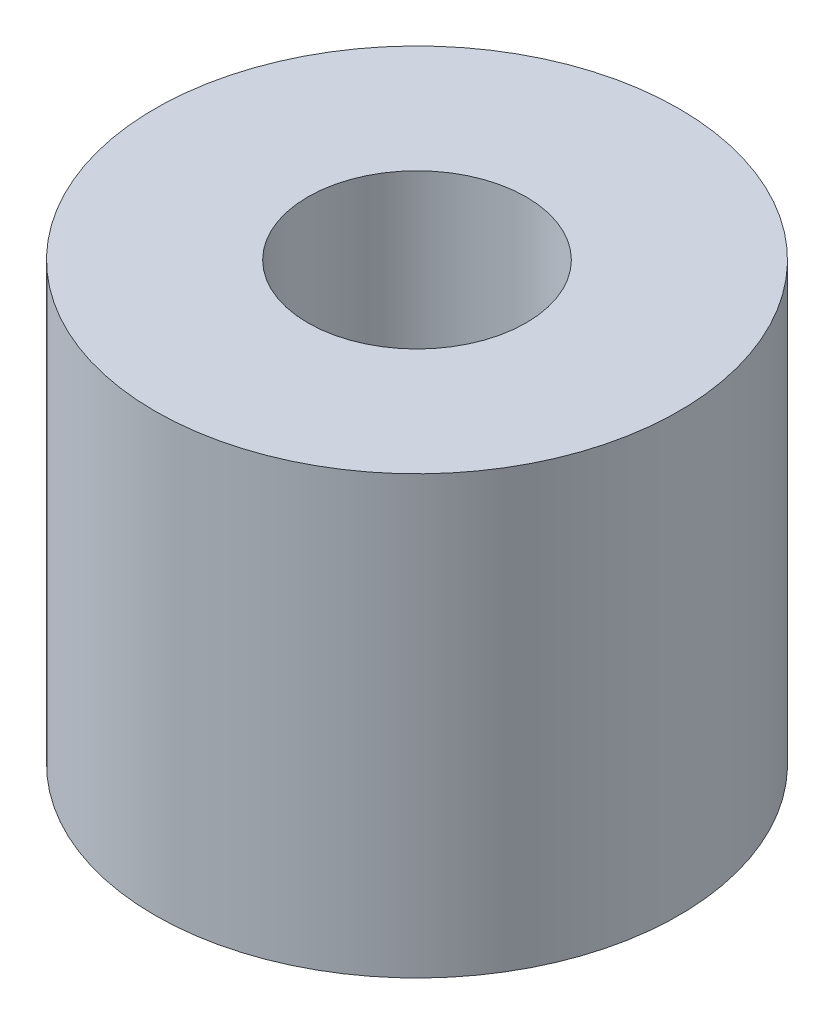
from build123d import *

# Parameters (mm, degrees)
CROQUIS1_R              = 25
SALIENTE_EXTRUIR1_DEPTH = 10
CROQUIS2_R              = 60
SALIENTE_EXTRUIR2_DEPTH = 100
CORTAR_EXTRUIR1_START   = -50
CROQUIS3_R              = 25
CORTAR_EXTRUIR1_DEPTH   = 50


with BuildPart() as part:
    # Croquis1 → Saliente-Extruir1 (new body)
    with BuildSketch(Plane(origin=(0, 0, 0), x_dir=(1, 0, 0), z_dir=(0, 1, 0))):
        with Locations(Location((0, 0, 0), (0, 0, 270))):
            Circle(CROQUIS1_R)
    extrude(amount=SALIENTE_EXTRUIR1_DEPTH)

    # Croquis2 → Saliente-Extruir2 (add)
    with BuildSketch(Plane(origin=(0, 10, 0), x_dir=(1, 0, 0), z_dir=(0, 1, 0))):
        with Locations(Location((0, 0, 0), (0, 0, 270))):
            Circle(CROQUIS2_R)
    extrude(amount=SALIENTE_EXTRUIR2_DEPTH)

    # Croquis3 → Cortar-Extruir1 (cut)
    with BuildSketch(Plane(origin=(0, 110, 0), x_dir=(1, 0, 0), z_dir=(0, 1, 0)).offset(CORTAR_EXTRUIR1_START)):
        with Locations(Location((0, 0, 0), (0, 0, 270))):
            Circle(CROQUIS3_R)
    extrude(amount=CORTAR_EXTRUIR1_DEPTH, mode=Mode.SUBTRACT)


solid = part.part
